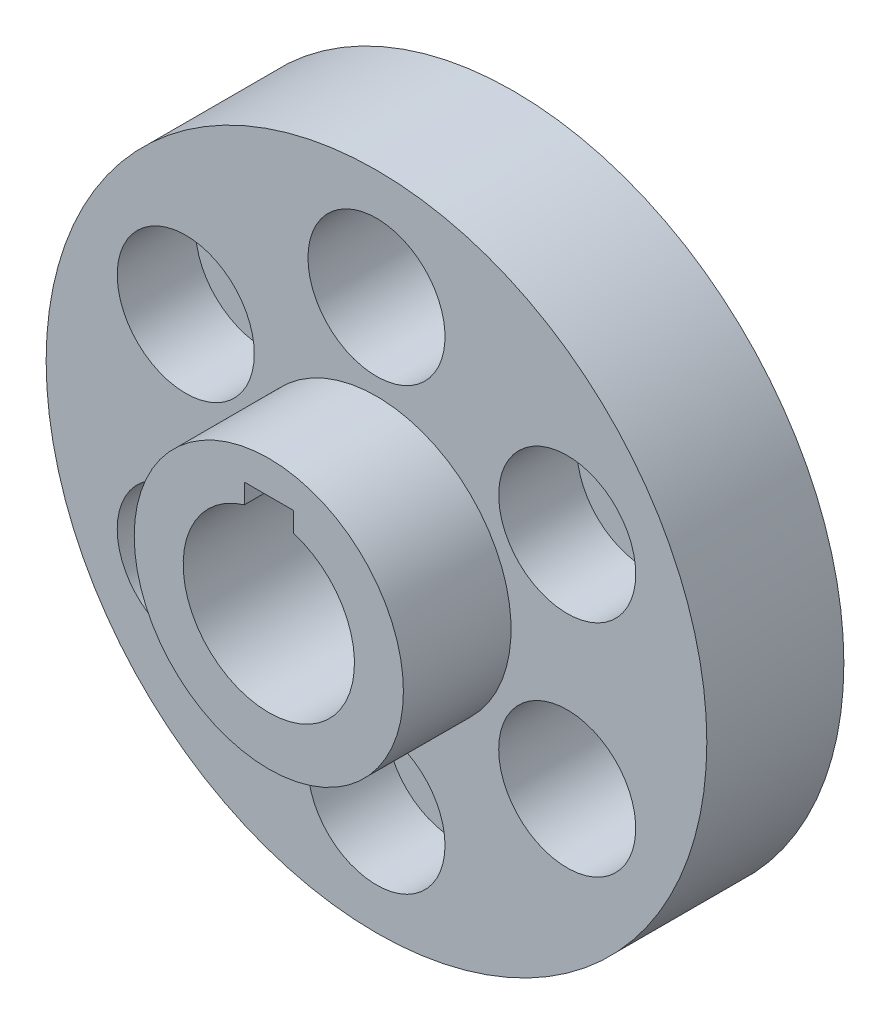
from build123d import *

# Parameters (mm, degrees)
SKETCH1_R                    = 27.5
BOSS_EXTRUDE1_DEPTH          = 50
SKETCH2_R                    = 67.5
SKETCH2_R_2                  = 14
BOSS_EXTRUDE2_DEPTH          = 28
SKETCH3_R                    = 9
CUT_EXTRUDE1_DEPTH           = 12
CUT_EXTRUDE1_DRAFT           = -7.5
CUT_EXTRUDE1_PROFILE_2_DEPTH = 12
CUT_EXTRUDE1_PROFILE_2_DRAFT = -7.5
CUT_EXTRUDE1_PROFILE_3_DEPTH = 12
CUT_EXTRUDE1_PROFILE_3_DRAFT = -7.5
SKETCH4_R                    = 14
CUT_EXTRUDE2_DEPTH           = 16
CUT_EXTRUDE3_START           = -50
CUT_EXTRUDE3_DEPTH           = 50


with BuildPart() as part:
    # Sketch1 → Boss-Extrude1 (new body)
    with BuildSketch(Plane.XY):
        Circle(SKETCH1_R)
        with BuildLine():
            Line((-5, 20.8), (5, 20.8))
            Line((5, 20.8), (5, 16.770509831))
            ThreePointArc((5, 16.770509831), (0, -17.5), (-5, 16.770509831))
            Line((-5, 16.770509831), (-5, 20.8))
        make_face(mode=Mode.SUBTRACT)
    extrude(amount=BOSS_EXTRUDE1_DEPTH)

    # Sketch2 → Boss-Extrude2 (add)
    with BuildSketch(Plane(origin=(0, 0, 0), x_dir=(-1, 0, 0), z_dir=(0, 0, -1))):
        Circle(SKETCH2_R)
        with Locations((0, 45)):
            Circle(SKETCH2_R_2, mode=Mode.SUBTRACT)
        with Locations((38.97114317, -22.5)):
            Circle(SKETCH2_R_2, mode=Mode.SUBTRACT)
        with Locations((-38.97114317, -22.5)):
            Circle(SKETCH2_R_2, mode=Mode.SUBTRACT)
    extrude(amount=-BOSS_EXTRUDE2_DEPTH)


with BuildPart() as cut_extrude1_tool:
    # Sketch3 → Cut-Extrude1 (with draft: the straight prism first)
    with BuildSketch(Plane(origin=(0, 0, 0), x_dir=(-1, 0, 0), z_dir=(0, 0, -1))):
        with Locations((0, -45)):
            Circle(SKETCH3_R)
    extrude(amount=-CUT_EXTRUDE1_DEPTH)
    # Cut-Extrude1: the draft: its side faces are tilted about the plane it starts from
    cut_extrude1_sides = [cut_extrude1_tool.faces().sort_by_distance(p)[0] for p in [
        (9, -45, 6),
    ]]
    draft(cut_extrude1_sides, Plane(origin=(0, 0, 0), x_dir=(-1, 0, 0), z_dir=(0, 0, -1)), CUT_EXTRUDE1_DRAFT)


with BuildPart() as part_1:
    add(part.part)

    # Cut-Extrude1: cut by cut_extrude1_tool
    add(cut_extrude1_tool.part, mode=Mode.SUBTRACT)


with BuildPart() as cut_extrude1_profile_2_tool:
    # Sketch3 → Cut-Extrude1 profile 2 (with draft: the straight prism first)
    with BuildSketch(Plane(origin=(0, 0, 0), x_dir=(-1, 0, 0), z_dir=(0, 0, -1))):
        with Locations((-38.97114317, 22.5)):
            Circle(SKETCH3_R)
    extrude(amount=-CUT_EXTRUDE1_PROFILE_2_DEPTH)
    # Cut-Extrude1 profile 2: the draft: its side faces are tilted about the plane it starts from
    cut_extrude1_profile_2_sides = [cut_extrude1_profile_2_tool.faces().sort_by_distance(p)[0] for p in [
        (47.97114317, 22.5, 6),
    ]]
    draft(cut_extrude1_profile_2_sides, Plane(origin=(0, 0, 0), x_dir=(-1, 0, 0), z_dir=(0, 0, -1)), CUT_EXTRUDE1_PROFILE_2_DRAFT)


with BuildPart() as part_2:
    add(part_1.part)

    # Cut-Extrude1 profile 2: cut by cut_extrude1_profile_2_tool
    add(cut_extrude1_profile_2_tool.part, mode=Mode.SUBTRACT)


with BuildPart() as cut_extrude1_profile_3_tool:
    # Sketch3 → Cut-Extrude1 profile 3 (with draft: the straight prism first)
    with BuildSketch(Plane(origin=(0, 0, 0), x_dir=(-1, 0, 0), z_dir=(0, 0, -1))):
        with Locations((38.97114317, 22.5)):
            Circle(SKETCH3_R)
    extrude(amount=-CUT_EXTRUDE1_PROFILE_3_DEPTH)
    # Cut-Extrude1 profile 3: the draft: its side faces are tilted about the plane it starts from
    cut_extrude1_profile_3_sides = [cut_extrude1_profile_3_tool.faces().sort_by_distance(p)[0] for p in [
        (-29.97114317, 22.5, 6),
    ]]
    draft(cut_extrude1_profile_3_sides, Plane(origin=(0, 0, 0), x_dir=(-1, 0, 0), z_dir=(0, 0, -1)), CUT_EXTRUDE1_PROFILE_3_DRAFT)


with BuildPart() as part_3:
    add(part_2.part)

    # Cut-Extrude1 profile 3: cut by cut_extrude1_profile_3_tool
    add(cut_extrude1_profile_3_tool.part, mode=Mode.SUBTRACT)

    # Sketch4 → Cut-Extrude2 (cut)
    with BuildSketch(Plane.XY.offset(28)):
        with Locations((0, -45)):
            Circle(SKETCH4_R)
        with Locations((-38.97114317, 22.5)):
            Circle(SKETCH4_R)
        with Locations((38.97114317, 22.5)):
            Circle(SKETCH4_R)
    extrude(amount=-CUT_EXTRUDE2_DEPTH, mode=Mode.SUBTRACT)

    # Sketch7 → Cut-Extrude3 (cut)
    with BuildSketch(Plane.XY.offset(28).offset(CUT_EXTRUDE3_START)):
        with BuildLine():
            Line((-5, 16.770509831), (-5, 20.8))
            Line((-5, 20.8), (5, 20.8))
            Line((5, 20.8), (5, 16.770509831))
            ThreePointArc((5, 16.770509831), (0, -17.5), (-5, 16.770509831))
        make_face()
    extrude(amount=CUT_EXTRUDE3_DEPTH, mode=Mode.SUBTRACT)


solid = part_3.part
